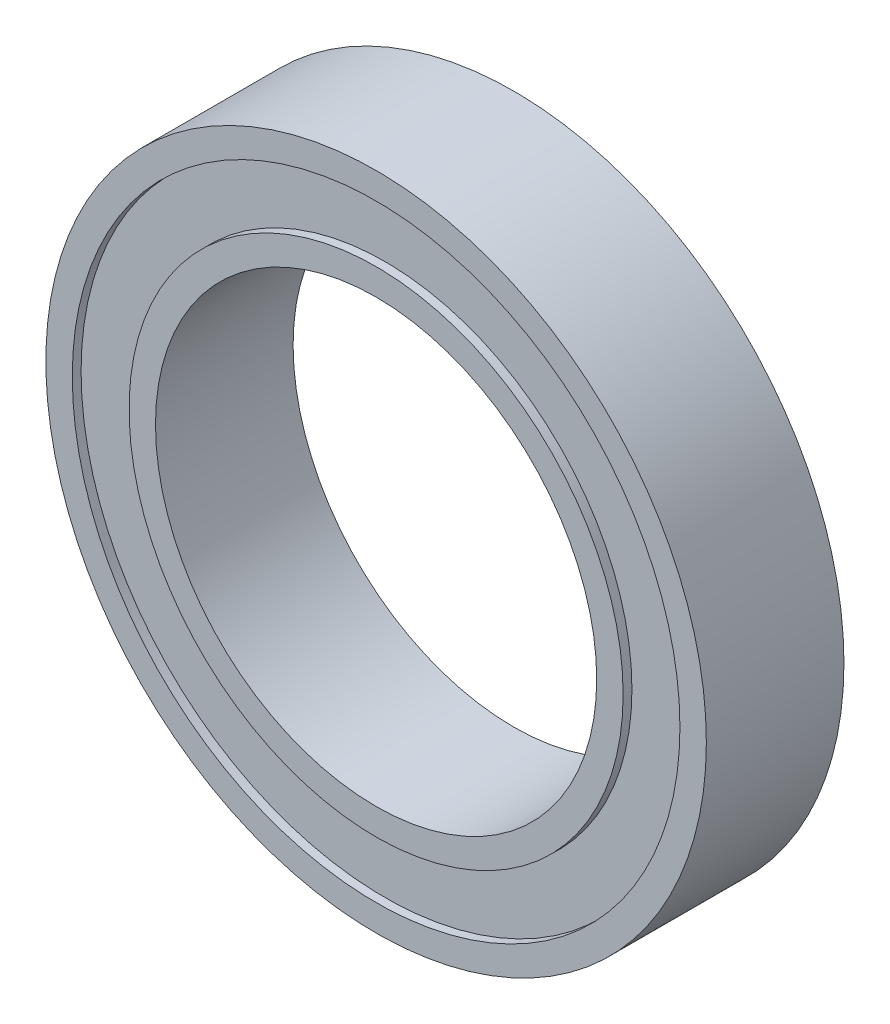
from build123d import *

# Parameters (mm, degrees)
SKETCH1_R           = 9.525
SKETCH1_R_2         = 6.3627
BOSS_EXTRUDE1_DEPTH = 1.984375
SKETCH2_R           = 8.763
SKETCH2_R_2         = 7.1247
CUT_EXTRUDE1_DEPTH  = 0.254


with BuildPart() as part:
    # Sketch1 → Boss-Extrude1 (new, symmetric)
    with BuildSketch(Plane.XY):
        Circle(SKETCH1_R)
        Circle(SKETCH1_R_2, mode=Mode.SUBTRACT)
    extrude(amount=BOSS_EXTRUDE1_DEPTH, both=True)

    # Sketch2 → Cut-Extrude1 (cut)
    with BuildSketch(Plane.XY.offset(1.984375)):
        Circle(SKETCH2_R)
        Circle(SKETCH2_R_2, mode=Mode.SUBTRACT)
    cut_extrude1 = extrude(amount=-CUT_EXTRUDE1_DEPTH, mode=Mode.SUBTRACT)

    # Mirror1: Cut-Extrude1 across plane
    add(cut_extrude1.mirror(Plane.XY), mode=Mode.SUBTRACT)


solid = part.part
